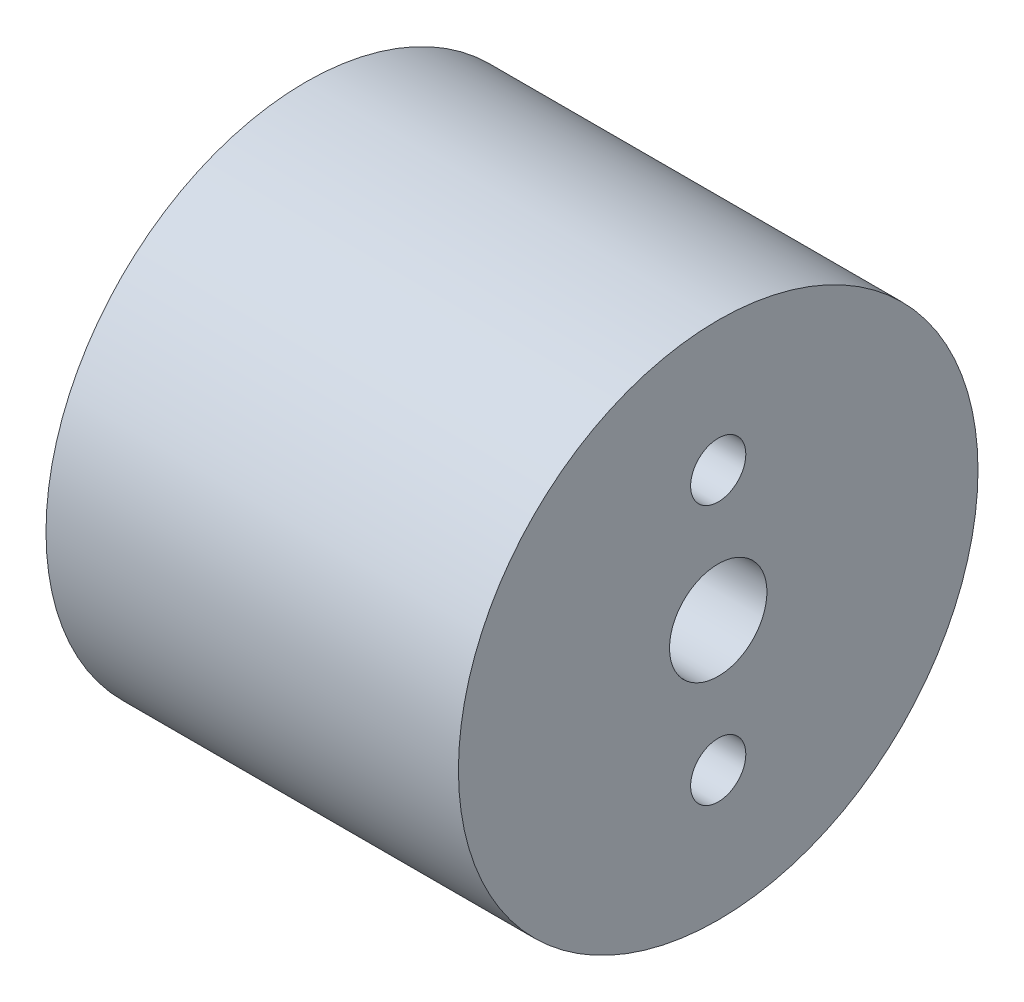
from build123d import *

# Parameters (mm, degrees)
SKETCH1_R           = 16
SKETCH1_R_2         = 11.4
BOSS_EXTRUDE1_DEPTH = 6.7
SKETCH2_R           = 16
SKETCH2_R_2         = 10.7
BOSS_EXTRUDE2_DEPTH = 3.2
SKETCH3_R           = 16
SKETCH3_R_2         = 6.2
BOSS_EXTRUDE3_DEPTH = 1
SKETCH4_R           = 16
SKETCH4_R_2         = 4.7
BOSS_EXTRUDE4_DEPTH = 7
SKETCH5_R           = 16
SKETCH5_R_2         = 3
BOSS_EXTRUDE5_DEPTH = 7.5
SKETCH6_R           = 1.7
CUT_EXTRUDE1_DEPTH  = 25.4


with BuildPart() as part:
    # Sketch1 → Boss-Extrude1 (new body)
    with BuildSketch(Plane(origin=(0, 0, 0), x_dir=(0, 0, -1), z_dir=(1, 0, 0))):
        Circle(SKETCH1_R)
        Circle(SKETCH1_R_2, mode=Mode.SUBTRACT)
    extrude(amount=BOSS_EXTRUDE1_DEPTH)

    # Sketch2 → Boss-Extrude2 (add)
    with BuildSketch(Plane(origin=(6.7, 0, 0), x_dir=(0, 0, -1), z_dir=(1, 0, 0))):
        Circle(SKETCH2_R)
        Circle(SKETCH2_R_2, mode=Mode.SUBTRACT)
    extrude(amount=BOSS_EXTRUDE2_DEPTH)

    # Sketch3 → Boss-Extrude3 (add)
    with BuildSketch(Plane(origin=(9.9, 0, 0), x_dir=(0, 0, -1), z_dir=(1, 0, 0))):
        Circle(SKETCH3_R)
        Circle(SKETCH3_R_2, mode=Mode.SUBTRACT)
    extrude(amount=BOSS_EXTRUDE3_DEPTH)

    # Sketch4 → Boss-Extrude4 (add)
    with BuildSketch(Plane(origin=(10.9, 0, 0), x_dir=(0, 0, -1), z_dir=(1, 0, 0))):
        Circle(SKETCH4_R)
        Circle(SKETCH4_R_2, mode=Mode.SUBTRACT)
    extrude(amount=BOSS_EXTRUDE4_DEPTH)

    # Sketch5 → Boss-Extrude5 (add)
    with BuildSketch(Plane(origin=(17.9, 0, 0), x_dir=(0, 0, -1), z_dir=(1, 0, 0))):
        Circle(SKETCH5_R)
        with Locations(Location((0, 0, 0), (0, 0, 180))):
            Circle(SKETCH5_R_2, mode=Mode.SUBTRACT)
    extrude(amount=BOSS_EXTRUDE5_DEPTH)

    # Sketch6 → Cut-Extrude1 (cut)
    with BuildSketch(Plane(origin=(25.4, 0, 0), x_dir=(0, 0, -1), z_dir=(1, 0, 0))):
        with Locations((0, 8)):
            Circle(SKETCH6_R)
        with Locations((0, -8)):
            Circle(SKETCH6_R)
    extrude(amount=-CUT_EXTRUDE1_DEPTH, mode=Mode.SUBTRACT)


solid = part.part
